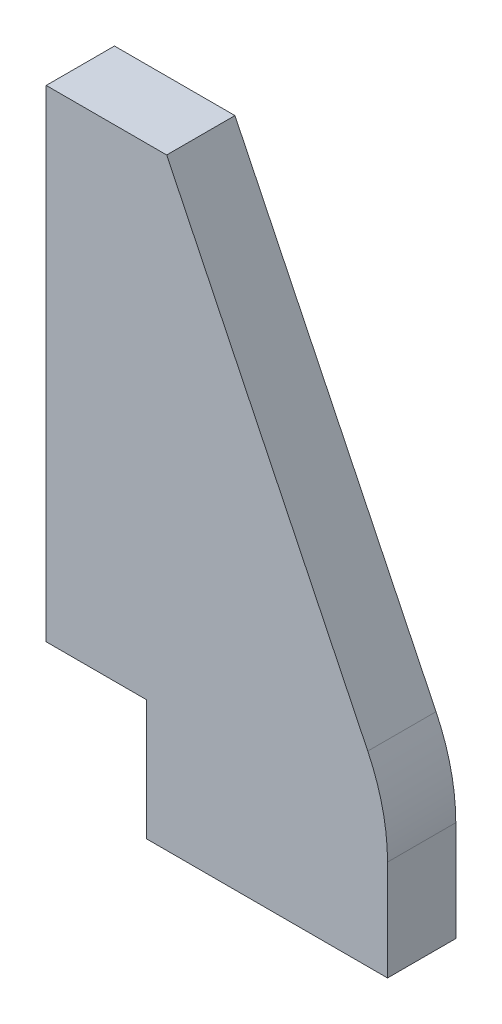
from build123d import *

# Parameters (mm, degrees)
ESTRUSIONE_ESTRUSIONE1_DEPTH = 17
SCHIZZO2_W                   = 25
SCHIZZO2_H                   = 30
TAGLIO_ESTRUSIONE1_DEPTH     = 17


with BuildPart() as part:
    # Schizzo1 → Estrusione-Estrusione1 (new body)
    with BuildSketch(Plane.XY):
        with BuildLine():
            Line((0, 0), (85, 0))
            Line((85, 0), (85, 25))
            ThreePointArc((85, 25), (83.753843891, 36.016505892), (80.078350515, 46.47628866))
            Line((80.078350515, 46.47628866), (30, 150))
            Line((30, 150), (0, 150))
            Line((0, 150), (0, 0))
        make_face()
    extrude(amount=ESTRUSIONE_ESTRUSIONE1_DEPTH)

    # Schizzo2 → Taglio-Estrusione1 (cut)
    with BuildSketch(Plane(origin=(0, 0, 0), x_dir=(-1, 0, 0), z_dir=(0, 0, -1))):
        with Locations((-12.5, 15)):
            Rectangle(SCHIZZO2_W, SCHIZZO2_H)
    extrude(amount=-TAGLIO_ESTRUSIONE1_DEPTH, mode=Mode.SUBTRACT)


solid = part.part
